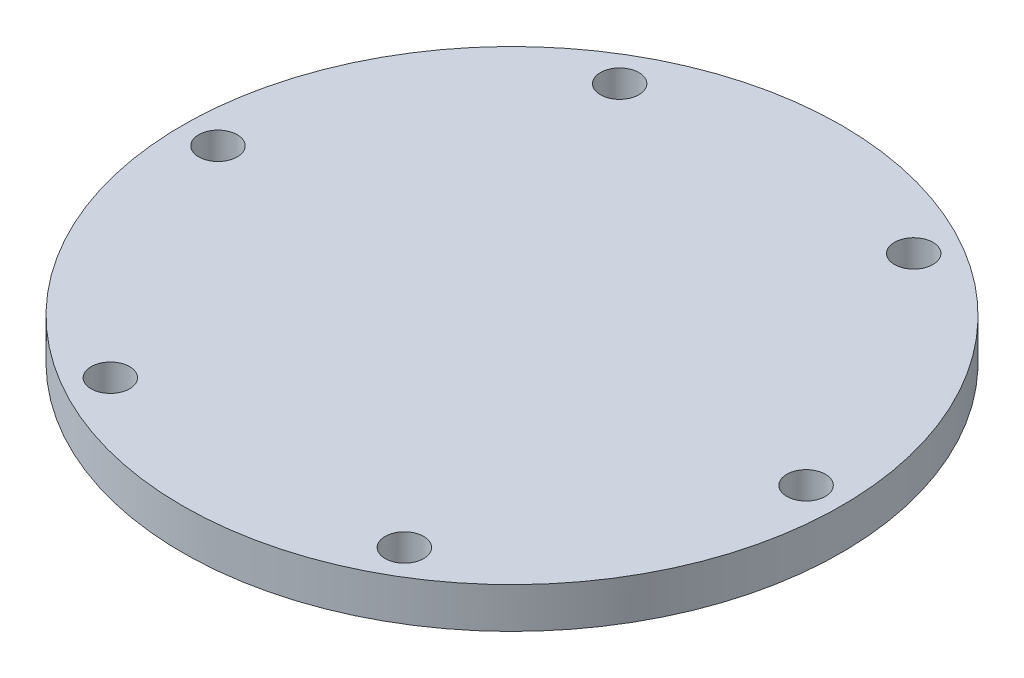
from build123d import *

# Parameters (mm, degrees)
SKETCH1_R            = 41.275
BODY_DEPTH           = 17.78
SKETCH2_R            = 41.275
SKETCH2_R_2          = 32.385
BOTTOM_INITIAL_DEPTH = 12.7
SKETCH3_R            = 32.385
SKETCH3_R_2          = 13.97
BOTTOM_STEM_DEPTH    = 7.62
SKETCH4_W            = 2.286
SKETCH4_H            = 2.54
SKETCH5_W            = 2.286
SKETCH5_H            = 2.54
CHAMFER1_SIZE        = 2.54
CHAMFER1_SIZE2       = 13.97
CUT_EXTRUDE3_REACH   = 63.02
SKETCH9_R            = 2.413
CIRPATTERN1_COUNT    = 6


with BuildPart() as part:
    # Sketch1 → Body (new body)
    with BuildSketch(Plane(origin=(0, 0, 0), x_dir=(1, 0, 0), z_dir=(0, 1, 0))):
        with Locations(Location((0, 0, 0), (0, 0, 270))):
            Circle(SKETCH1_R)
    extrude(amount=BODY_DEPTH)

    # Sketch2 → Bottom Initial (cut)
    with BuildSketch(Plane.XZ):
        with Locations(Location((0, 0, 0), (0, 0, 270))):
            Circle(SKETCH2_R)
        with Locations(Location((0, 0, 0), (0, 0, 270))):
            Circle(SKETCH2_R_2, mode=Mode.SUBTRACT)
    extrude(amount=-BOTTOM_INITIAL_DEPTH, mode=Mode.SUBTRACT)

    # Sketch3 → Bottom Stem (cut)
    with BuildSketch(Plane.XZ):
        with Locations(Location((0, 0, 0), (0, 0, 270))):
            Circle(SKETCH3_R)
        with Locations(Location((0, 0, 0), (0, 0, 270))):
            Circle(SKETCH3_R_2, mode=Mode.SUBTRACT)
    extrude(amount=-BOTTOM_STEM_DEPTH, mode=Mode.SUBTRACT)

    # Sketch4 → Top O ring (revolve, cut)
    with BuildSketch(Plane.XY, mode=Mode.PRIVATE) as top_o_ring_sk:
        with Locations((31.242, 10.16)):
            Rectangle(SKETCH4_W, SKETCH4_H)
    revolve(top_o_ring_sk.sketch.rotate(Axis((0, 18.669, 0), (0, -1, 0)), 270), axis=Axis((0, 18.669, 0), (0, -1, 0)), mode=Mode.SUBTRACT)

    # Sketch5 → Bottom O ring (revolve, cut)
    with BuildSketch(Plane.XY, mode=Mode.PRIVATE) as bottom_o_ring_sk:
        with Locations((12.827, 5.08)):
            Rectangle(SKETCH5_W, SKETCH5_H)
    revolve(bottom_o_ring_sk.sketch.rotate(Axis((0, 18.669, 0), (0, -1, 0)), 270), axis=Axis((0, 18.669, 0), (0, -1, 0)), mode=Mode.SUBTRACT)

    # Chamfer1
    chamfer1_edges = [part.edges().sort_by_distance(p)[0] for p in [
        (0, 0, 13.97),
    ]]
    chamfer1_side = [part.faces().sort_by_distance(p)[0] for p in [
        (0, 1.905, 13.97),
    ]]
    chamfer(chamfer1_edges, length=CHAMFER1_SIZE, length2=CHAMFER1_SIZE2, reference=chamfer1_side[0])

    # Sketch9 → Cut-Extrude3 (cut, up to next)
    with BuildSketch(Plane(origin=(0, 17.78, 0), x_dir=(1, 0, 0), z_dir=(0, 1, 0)), mode=Mode.PRIVATE) as cut_extrude3_sk1:
        with Locations(Location((-36.83, 0, 0), (0, 0, 270))):
            Circle(SKETCH9_R)
    cut_extrude3_tool1 = extrude(cut_extrude3_sk1.sketch, amount=-CUT_EXTRUDE3_REACH, mode=Mode.PRIVATE) & part.part
    cut_extrude3 = cut_extrude3_tool1.solids().sort_by_distance((-36.83, 17.78, 0))[0]
    add(cut_extrude3, mode=Mode.SUBTRACT)

    # CirPattern1: Cut-Extrude3 ×6 about axis
    cirpattern1_axis = Axis((0, 0, 0), (0, 1, 0))
    for i in range(1, CIRPATTERN1_COUNT):
        add(cut_extrude3.rotate(cirpattern1_axis, i * 360 / CIRPATTERN1_COUNT), mode=Mode.SUBTRACT)


solid = part.part
